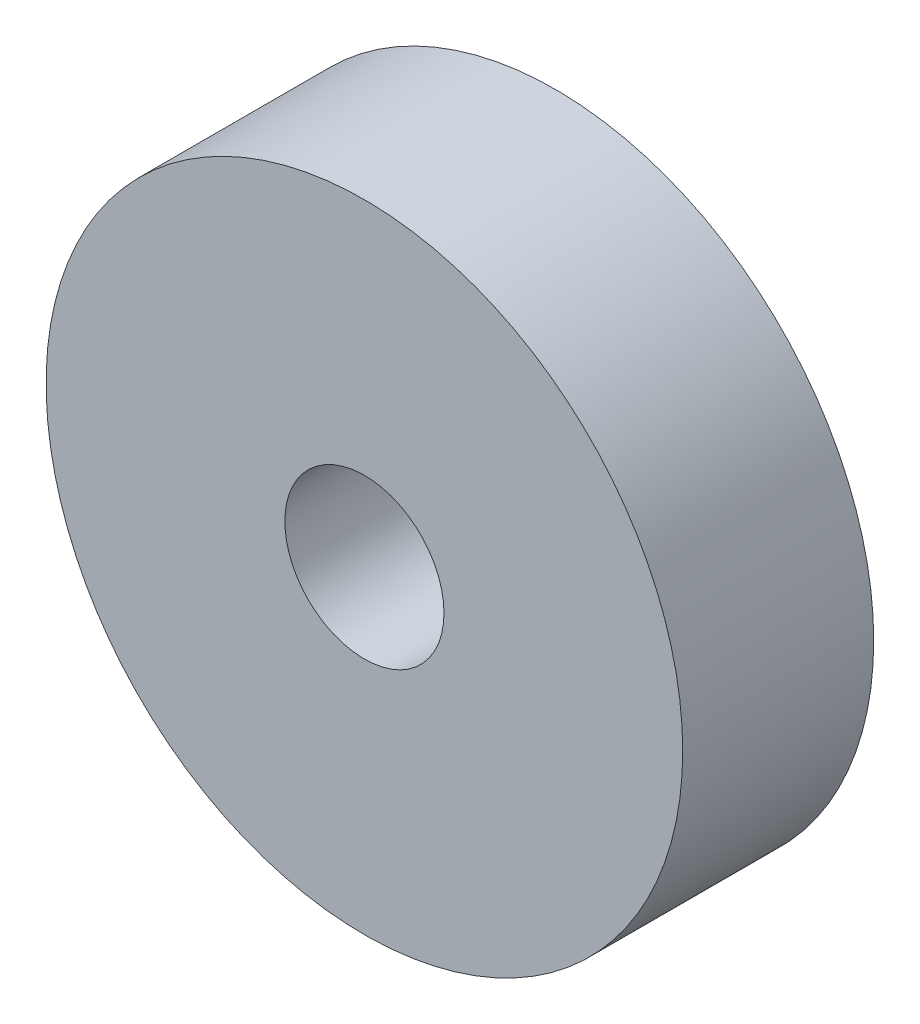
from build123d import *

# Parameters (mm, degrees)
SKETCH_1_R          = 5
EXTRUDE_1_DEPTH     = 3
SKETCH_2_R          = 1.25
CUT_EXTRUDE_1_DEPTH = 8


with BuildPart() as part:
    # 草图1 → 凸台-拉伸1 (new body)
    with BuildSketch(Plane.XY):
        Circle(SKETCH_1_R)
    extrude(amount=EXTRUDE_1_DEPTH)

    # 草图2 → 切除-拉伸1 (cut)
    with BuildSketch(Plane.XY.offset(3)):
        Circle(SKETCH_2_R)
    extrude(amount=-CUT_EXTRUDE_1_DEPTH, mode=Mode.SUBTRACT)


solid = part.part
